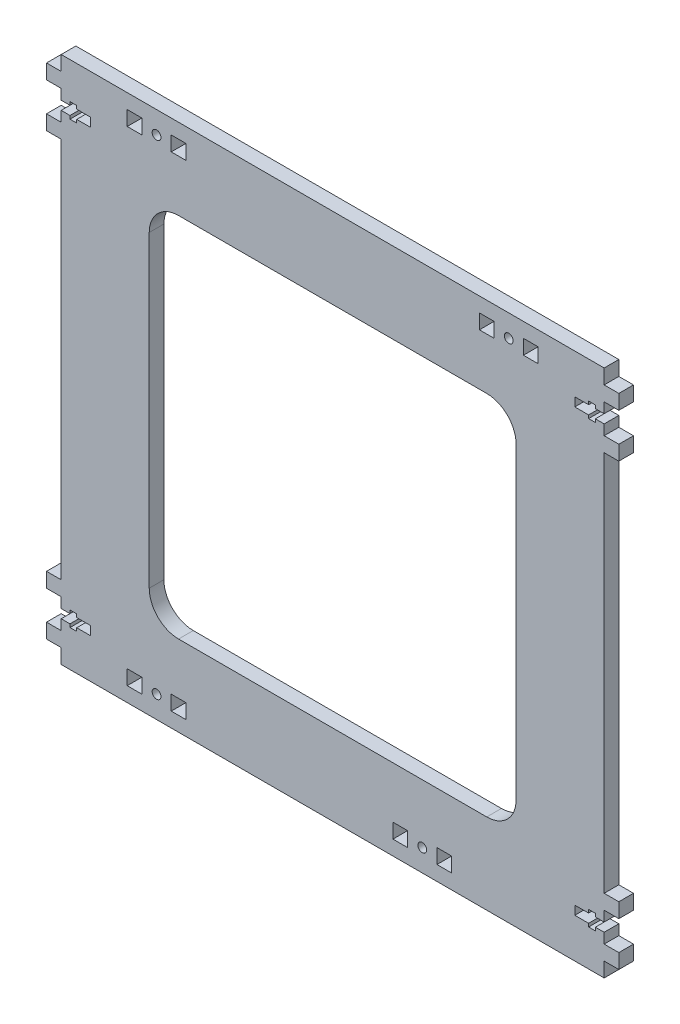
from build123d import *

# Parameters (mm, degrees)
SKETCH1_R           = 1.5
SKETCH1_W           = 125
SKETCH1_H           = 124.954514062
SKETCH1_W_2         = 5
SKETCH1_H_2         = 5
BOSS_EXTRUDE1_DEPTH = 5
FILLET1_R           = 10


with BuildPart() as part:
    # Sketch1 → Boss-Extrude1 (new body)
    with BuildSketch(Plane.XY):
        Polygon((92.5, 62.5), (92.5, -62.5), (92.5, -65), (97.5, -65), (97.5, -70), (92.5, -70), (92.5, -73.5), (89.5, -73.5), (89.5, -72.4), (87.2, -72.4), (87.2, -73.5), (82.5, -73.5), (82.5, -76.5), (87.2, -76.5), (87.2, -77.6), (89.5, -77.6), (89.5, -76.5), (92.5, -76.5), (92.5, -80), (97.5, -80), (97.5, -85), (92.5, -85), (92.5, -90), (-92.5, -90), (-92.5, -85), (-97.5, -85), (-97.5, -80), (-92.5, -80), (-92.5, -76.5), (-89.5, -76.5), (-89.5, -77.6), (-87.2, -77.6), (-87.2, -76.5), (-82.5, -76.5), (-82.5, -73.5), (-87.2, -73.5), (-87.2, -72.4), (-89.5, -72.4), (-89.5, -73.5), (-92.5, -73.5), (-92.5, -70), (-97.5, -70), (-97.5, -65), (-92.5, -65), (-92.5, 65), (-97.5, 65), (-97.5, 70), (-92.5, 70), (-92.5, 73.5), (-89.5, 73.5), (-89.5, 72.4), (-87.2, 72.4), (-87.2, 73.5), (-82.5, 73.5), (-82.5, 76.5), (-87.2, 76.5), (-87.2, 77.6), (-89.5, 77.6), (-89.5, 76.5), (-92.5, 76.5), (-92.5, 80), (-97.5, 80), (-97.5, 85), (-92.5, 85), (-92.5, 90), (92.5, 90), (92.5, 85), (97.5, 85), (97.5, 80), (92.5, 80), (92.5, 76.5), (89.5, 76.5), (89.5, 77.6), (87.2, 77.6), (87.2, 76.5), (82.5, 76.5), (82.5, 73.5), (87.2, 73.5), (87.2, 72.4), (89.5, 72.4), (89.5, 73.5), (92.5, 73.5), (92.5, 70), (97.5, 70), (97.5, 65), (92.5, 65), align=None)
        with Locations((60, 82.5)):
            Circle(SKETCH1_R, mode=Mode.SUBTRACT)
        with Locations((-60, -82.5)):
            Circle(SKETCH1_R, mode=Mode.SUBTRACT)
        with Locations(Location((-60, 82.5, 0), (0, 0, 180))):
            Circle(SKETCH1_R, mode=Mode.SUBTRACT)
        with Locations(Location((30.537723616, -82.5, 0), (0, 0, 90))):
            Circle(SKETCH1_R, mode=Mode.SUBTRACT)
        Rectangle(SKETCH1_W, SKETCH1_H, mode=Mode.SUBTRACT)
        with Locations((52.5, 82.5)):
            Rectangle(SKETCH1_W_2, SKETCH1_H_2, mode=Mode.SUBTRACT)
        with Locations((67.5, 82.5)):
            Rectangle(SKETCH1_W_2, SKETCH1_H_2, mode=Mode.SUBTRACT)
        with Locations((-52.5, -82.5)):
            Rectangle(SKETCH1_W_2, SKETCH1_H_2, mode=Mode.SUBTRACT)
        with Locations((-67.5, -82.5)):
            Rectangle(SKETCH1_W_2, SKETCH1_H_2, mode=Mode.SUBTRACT)
        with Locations((-52.5, 82.5)):
            Rectangle(SKETCH1_W_2, SKETCH1_H_2, mode=Mode.SUBTRACT)
        with Locations((-67.5, 82.5)):
            Rectangle(SKETCH1_W_2, SKETCH1_H_2, mode=Mode.SUBTRACT)
        with Locations((23.037723616, -82.5)):
            Rectangle(SKETCH1_W_2, SKETCH1_H_2, mode=Mode.SUBTRACT)
        with Locations((38.037723616, -82.5)):
            Rectangle(SKETCH1_W_2, SKETCH1_H_2, mode=Mode.SUBTRACT)
    extrude(amount=BOSS_EXTRUDE1_DEPTH)

    # Fillet1
    fillet1_edges = [part.edges().sort_by_distance(p)[0] for p in [
        (62.5, -62.477257031, 2.5),
        (62.5, 62.477257031, 2.5),
        (-62.5, 62.477257031, 2.5),
        (-62.5, -62.477257031, 2.5),
    ]]
    fillet(fillet1_edges, radius=FILLET1_R)


solid = part.part
